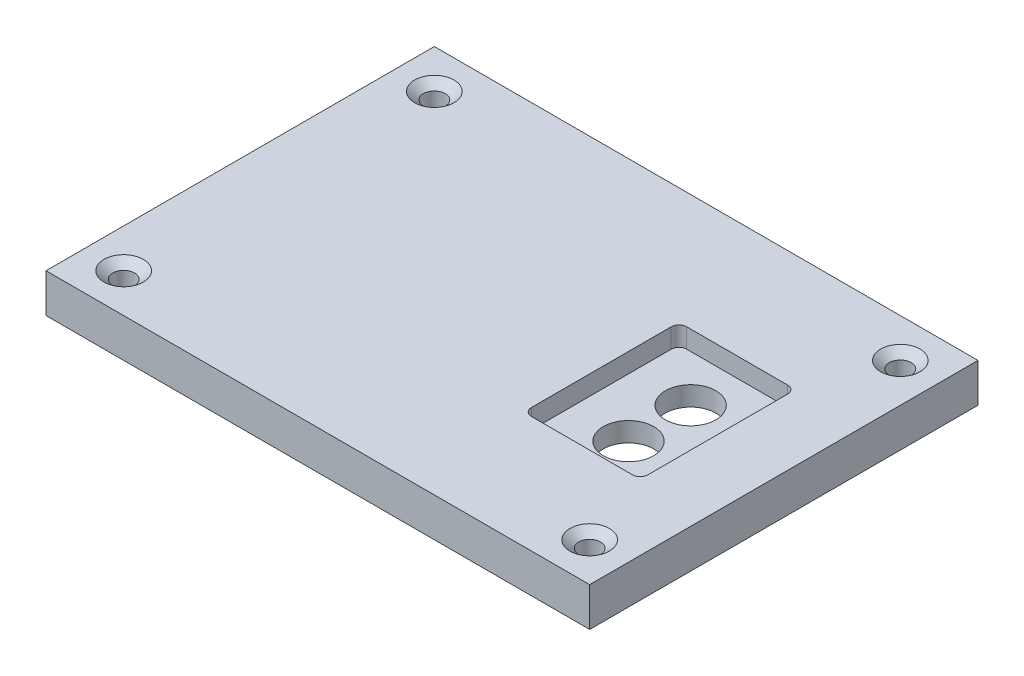
from build123d import *

# Parameters (mm, degrees)
SKETCH1_W                                           = 177.8
SKETCH1_H                                           = 127
BOSS_EXTRUDE1_DEPTH                                 = 12.7
CSK_FOR_1_4_FLAT_HEAD_MACHINE_SCREW_100_D           = 7.14248
CSK_FOR_1_4_FLAT_HEAD_MACHINE_SCREW_100_CSINK_D     = 12.8778
CSK_FOR_1_4_FLAT_HEAD_MACHINE_SCREW_100_CSINK_ANGLE = 100
SKETCH6_W                                           = 38.1
SKETCH6_H                                           = 50.8
CUT_EXTRUDE1_DEPTH                                  = 6.35
CUT_EXTRUDE2_REACH                                  = 111.434
SKETCH8_R                                           = 8.255
CUT_EXTRUDE3_REACH                                  = 111.434
SKETCH7_R                                           = 8.255
FILLET1_R                                           = 2.54


with BuildPart() as part:
    # Sketch1 → Boss-Extrude1 (new body)
    with BuildSketch(Plane(origin=(0, 0, 0), x_dir=(1, 0, 0), z_dir=(0, 1, 0))):
        Rectangle(SKETCH1_W, SKETCH1_H)
    extrude(amount=BOSS_EXTRUDE1_DEPTH)

    # CSK for 1/4 Flat Head Machine Screw (100)1 (through all)
    with Locations(Plane(origin=(0, 12.7, 0), x_dir=(1, 0, 0), z_dir=(0, 1, 0))):
        with Locations((-76.2, -50.8), (76.2, -50.8), (76.2, 50.8), (-76.2, 50.8)):
            CounterSinkHole(CSK_FOR_1_4_FLAT_HEAD_MACHINE_SCREW_100_D / 2, CSK_FOR_1_4_FLAT_HEAD_MACHINE_SCREW_100_CSINK_D / 2, counter_sink_angle=CSK_FOR_1_4_FLAT_HEAD_MACHINE_SCREW_100_CSINK_ANGLE)

    # Sketch6 → Cut-Extrude1 (cut)
    with BuildSketch(Plane(origin=(0, 12.7, 0), x_dir=(1, 0, 0), z_dir=(0, 1, 0))):
        with Locations((48.26, 0)):
            Rectangle(SKETCH6_W, SKETCH6_H)
    extrude(amount=-CUT_EXTRUDE1_DEPTH, mode=Mode.SUBTRACT)

    # Sketch8 → Cut-Extrude2 (cut, up to next)
    with BuildSketch(Plane(origin=(0, 6.35, 0), x_dir=(1, 0, 0), z_dir=(0, 1, 0)), mode=Mode.PRIVATE) as cut_extrude2_sk1:
        with Locations(Location((48.26, 10.16, 0), (0, 0, 270))):
            Circle(SKETCH8_R)
    cut_extrude2_tool1 = extrude(cut_extrude2_sk1.sketch, amount=-CUT_EXTRUDE2_REACH, mode=Mode.PRIVATE) & part.part
    add(cut_extrude2_tool1.solids().sort_by_distance((48.26, 6.35, -10.16))[0], mode=Mode.SUBTRACT)

    # Sketch7 → Cut-Extrude3 (cut, up to next)
    with BuildSketch(Plane(origin=(0, 6.35, 0), x_dir=(1, 0, 0), z_dir=(0, 1, 0)), mode=Mode.PRIVATE) as cut_extrude3_sk1:
        with Locations(Location((48.26, -10.16, 0), (0, 0, 270))):
            Circle(SKETCH7_R)
    cut_extrude3_tool1 = extrude(cut_extrude3_sk1.sketch, amount=-CUT_EXTRUDE3_REACH, mode=Mode.PRIVATE) & part.part
    add(cut_extrude3_tool1.solids().sort_by_distance((48.26, 6.35, 10.16))[0], mode=Mode.SUBTRACT)

    # Fillet1
    fillet1_edges = [part.edges().sort_by_distance(p)[0] for p in [
        (29.21, 9.525, -25.4),
        (67.31, 9.525, -25.4),
        (67.31, 9.525, 25.4),
        (29.21, 9.525, 25.4),
    ]]
    fillet(fillet1_edges, radius=FILLET1_R)


solid = part.part
